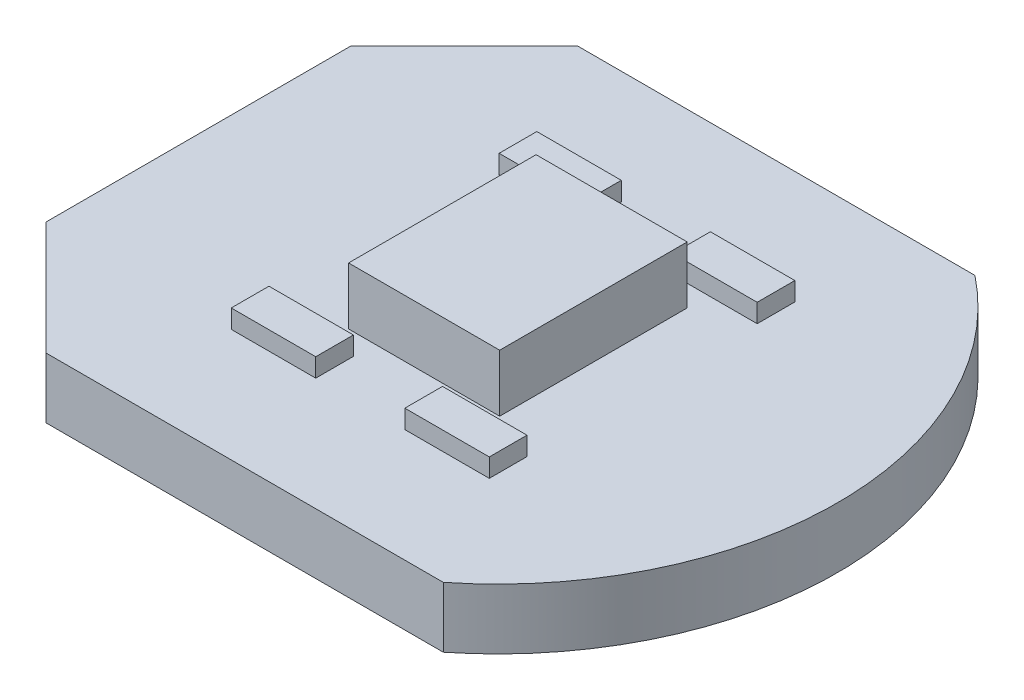
from build123d import *

# Parameters (mm, degrees)
BOSS_EXTRUDE1_DEPTH = 1.63
SKETCH2_W           = 4.07
SKETCH2_H           = 5.05
BOSS_EXTRUDE2_DEPTH = 1.54
SKETCH3_W           = 2.275
SKETCH3_H           = 1.015
BOSS_EXTRUDE3_DEPTH = 0.5


with BuildPart() as part:
    # Sketch1 → Boss-Extrude1 (new body)
    with BuildSketch(Plane(origin=(0, 0, 0), x_dir=(1, 0, 0), z_dir=(0, 1, 0))):
        with BuildLine():
            Line((-8.605, 4.105), (-8.605, -4.105))
            Line((-8.605, -4.105), (-5.55, -7.16))
            Line((-5.55, -7.16), (5.15, -7.16))
            ThreePointArc((5.15, -7.16), (8.605, 0), (5.15, 7.16))
            Line((5.15, 7.16), (-5.55, 7.16))
            Line((-5.55, 7.16), (-8.605, 4.105))
        make_face()
    extrude(amount=BOSS_EXTRUDE1_DEPTH)

    # Sketch2 → Boss-Extrude2 (add)
    with BuildSketch(Plane(origin=(0, 1.63, 0), x_dir=(1, 0, 0), z_dir=(0, 1, 0))):
        Rectangle(SKETCH2_W, SKETCH2_H)
    extrude(amount=BOSS_EXTRUDE2_DEPTH)

    # Sketch3 → Boss-Extrude3 (add)
    with BuildSketch(Plane(origin=(0, 1.63, 0), x_dir=(1, 0, 0), z_dir=(0, 1, 0))):
        with Locations((-2.4675, 3.6075)):
            Rectangle(SKETCH3_W, SKETCH3_H)
        with Locations((2.2075, 3.6075)):
            Rectangle(SKETCH3_W, SKETCH3_H)
        with Locations((-2.4675, -3.6075)):
            Rectangle(SKETCH3_W, SKETCH3_H)
        with Locations((2.2075, -3.6075)):
            Rectangle(SKETCH3_W, SKETCH3_H)
    extrude(amount=BOSS_EXTRUDE3_DEPTH)


solid = part.part
